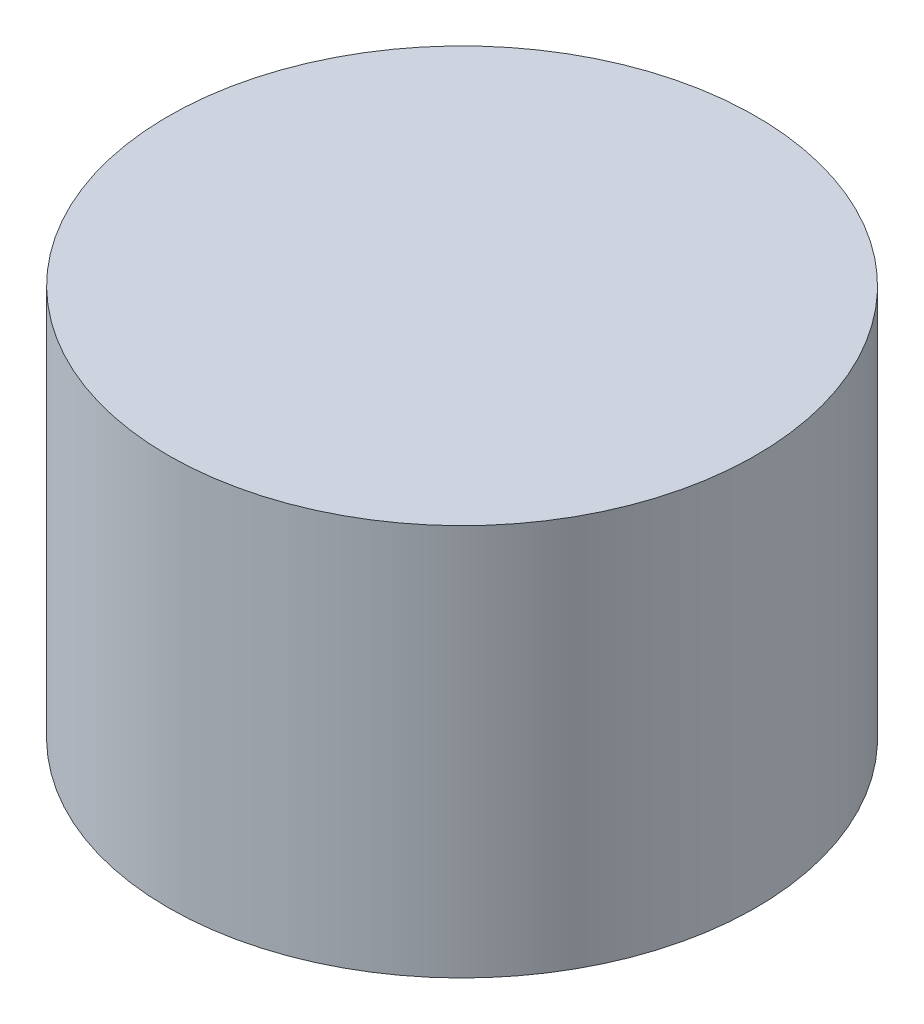
from build123d import *

# Parameters (mm, degrees)
SKETCH1_R           = 9
BOSS_EXTRUDE1_DEPTH = 12


with BuildPart() as part:
    # Sketch1 → Boss-Extrude1 (new body)
    with BuildSketch(Plane(origin=(0, 0, 0), x_dir=(1, 0, 0), z_dir=(0, 1, 0))):
        with Locations(Location((0, 0, 0), (0, 0, 270))):
            Circle(SKETCH1_R)
    extrude(amount=BOSS_EXTRUDE1_DEPTH)


solid = part.part
